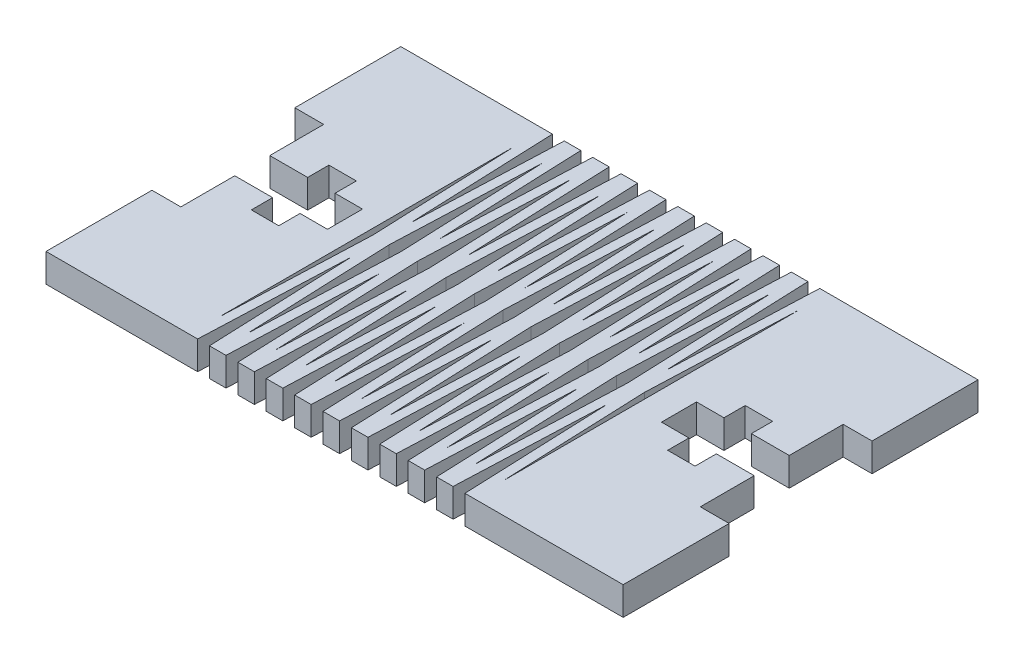
from build123d import *

# Parameters (mm, degrees)
SKETCH1_W            = 61
SKETCH1_H            = 37.5
BOSS_EXTRUDE1_DEPTH  = 3
CUT_EXTRUDE2_DEPTH   = 36.927879147
MIRROR2_COPY_1_DEPTH = 36.927879147
CUT_EXTRUDE3_DEPTH   = 36.927879147
LPATTERN1_COUNT      = 10
LPATTERN1_PITCH      = 3


with BuildPart() as part:
    # Sketch1 → Boss-Extrude1 (new body)
    with BuildSketch(Plane(origin=(0, 0, 0), x_dir=(1, 0, 0), z_dir=(0, 1, 0))):
        Rectangle(SKETCH1_W, SKETCH1_H)
    extrude(amount=BOSS_EXTRUDE1_DEPTH)

    # Sketch3 → Cut-Extrude2 (cut, through all)
    with BuildSketch(Plane(origin=(0, 3, 0), x_dir=(1, 0, 0), z_dir=(0, 1, 0))):
        Polygon((30.5, 7.55), (27.45, 7.55), (27.45, 1.85), (23.45, 1.85), (23.45, 4.1), (20.55, 4.1), (20.55, 1.85), (17.65, 1.85), (17.65, 0), (30.5, 0), align=None)
    cut_extrude2 = extrude(amount=-CUT_EXTRUDE2_DEPTH, mode=Mode.SUBTRACT)

    # Mirror1: Cut-Extrude2 across plane
    add(cut_extrude2.mirror(Plane.XY), mode=Mode.SUBTRACT)

    # Mirror2: Cut-Extrude2 across plane
    add(cut_extrude2.mirror(Plane(origin=(0, 0, 0), x_dir=(0, 0, 1), z_dir=(1, 0, 0))), mode=Mode.SUBTRACT)

    # Mirror2 copy 1 sketch → Mirror2 copy 1 (cut, through all)
    with BuildSketch(Plane(origin=(0, 3, 0), x_dir=(-1, 0, 0), z_dir=(0, 1, 0))):
        Polygon((30.5, 7.55), (27.45, 7.55), (27.45, 1.85), (23.45, 1.85), (23.45, 4.1), (20.55, 4.1), (20.55, 1.85), (17.65, 1.85), (17.65, 0), (30.5, 0), align=None)
    extrude(amount=-MIRROR2_COPY_1_DEPTH, mode=Mode.SUBTRACT)

    # Sketch4 → Cut-Extrude3 (cut, through all)
    with BuildSketch(Plane(origin=(0, 3, 0), x_dir=(1, 0, 0), z_dir=(0, 1, 0))):
        Polygon((14.65, 15.575), (14.65, -15.575), (14.0229932, 0), align=None)
        Polygon((13.7770068, 18.75), (13.15, 3.175), (12.5229932, 18.75), align=None)
        Polygon((13.15, -3.175), (12.5229932, -18.75), (13.7770068, -18.75), align=None)
        Polygon((11.65, 15.575), (11.65, -15.575), (12.2770068, 0), align=None)
    cut_extrude3 = extrude(amount=-CUT_EXTRUDE3_DEPTH, mode=Mode.SUBTRACT)

    # LPattern1: Cut-Extrude3 ×10
    with Locations(*[(-i * LPATTERN1_PITCH, 0, 0) for i in range(1, LPATTERN1_COUNT)]):
        add(cut_extrude3, mode=Mode.SUBTRACT)


solid = part.part
